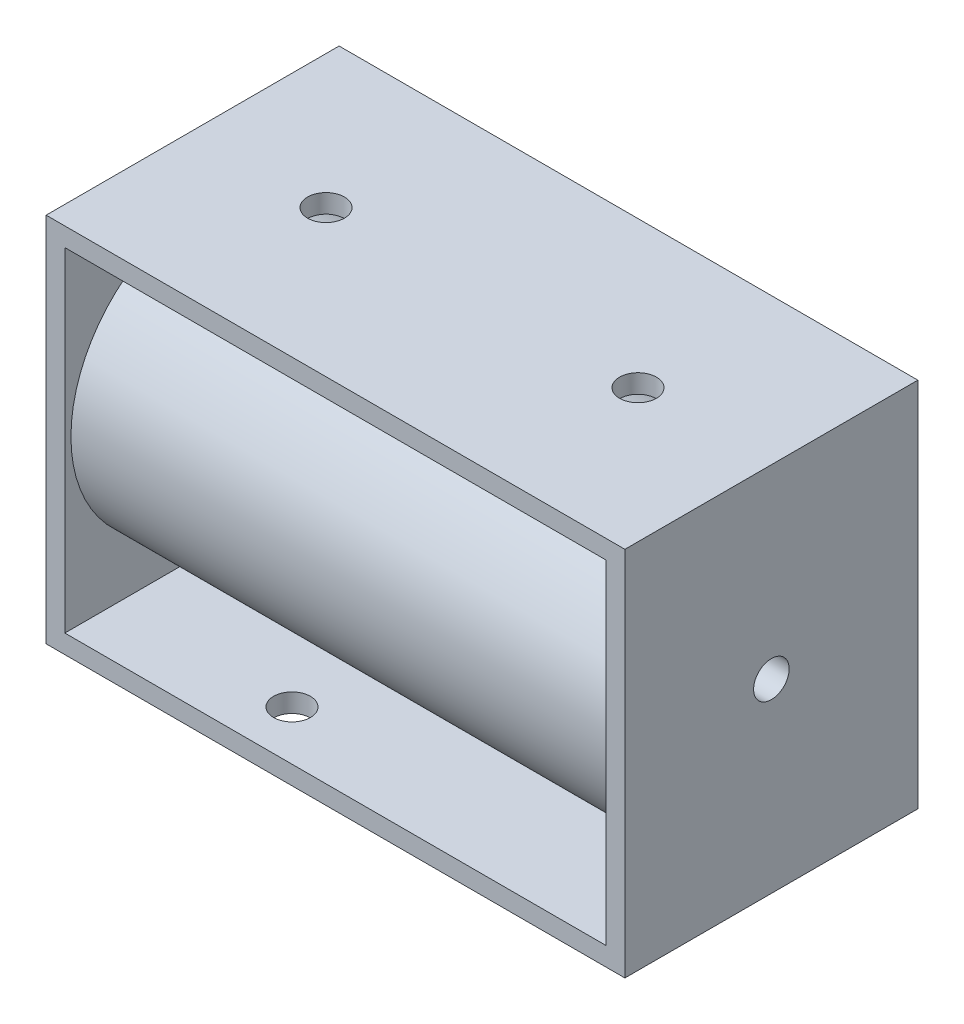
from build123d import *

# Parameters (mm, degrees)
SKETCH1_W           = 47.117
SKETCH1_H           = 30.226
BOSS_EXTRUDE1_DEPTH = 23.8506
SKETCH4_W           = 44.069
SKETCH4_H           = 27.178
CUT_EXTRUDE1_DEPTH  = 61.847957117
SKETCH5_R           = 11.43
BOSS_EXTRUDE3_DEPTH = 44.069
SKETCH3_R           = 1.4986
CUT_EXTRUDE2_DEPTH  = 2.54
CUT_EXTRUDE3_START  = -2.54
SKETCH6_R           = 1.4986
CUT_EXTRUDE3_DEPTH  = 2.54
SKETCH2_R           = 1.4478
CUT_EXTRUDE4_DEPTH  = 61.847957117
SKETCH7_R           = 4.1783
CUT_EXTRUDE5_DEPTH  = 32.1564
CHAMFER1_SIZE       = 4.064
CHAMFER1_SIZE2      = 2.346351494


with BuildPart() as part:
    # Sketch1 → Boss-Extrude1 (new body)
    with BuildSketch(Plane.XY):
        with Locations((23.5585, 15.113)):
            Rectangle(SKETCH1_W, SKETCH1_H)
    extrude(amount=BOSS_EXTRUDE1_DEPTH)

    # Sketch4 → Cut-Extrude1 (cut, through all)
    with BuildSketch(Plane.XY.offset(23.8506)):
        with Locations((23.5585, 15.113)):
            Rectangle(SKETCH4_W, SKETCH4_H)
    extrude(amount=-CUT_EXTRUDE1_DEPTH, mode=Mode.SUBTRACT)

    # Sketch5 → Boss-Extrude3 (add)
    with BuildSketch(Plane(origin=(1.524, 0, 0), x_dir=(0, 0, -1), z_dir=(1, 0, 0))):
        with Locations(Location((-11.9253, 15.113, 0), (0, 0, 180))):
            Circle(SKETCH5_R)
    extrude(amount=BOSS_EXTRUDE3_DEPTH)

    # Sketch3 → Cut-Extrude2 (cut)
    with BuildSketch(Plane(origin=(0, 30.226, 0), x_dir=(1, 0, 0), z_dir=(0, 1, 0))):
        with Locations(Location((10.8585, -11.9253, 0), (0, 0, 270))):
            Circle(SKETCH3_R)
        with Locations(Location((36.2585, -11.9253, 0), (0, 0, 270))):
            Circle(SKETCH3_R)
    extrude(amount=-CUT_EXTRUDE2_DEPTH, mode=Mode.SUBTRACT)

    # Sketch6 → Cut-Extrude3 (cut)
    with BuildSketch(Plane.XZ.offset(CUT_EXTRUDE3_START)):
        with Locations(Location((15.9766, 19.812, 0), (0, 0, 270))):
            Circle(SKETCH6_R)
        with Locations(Location((10.8585, 11.9253, 0), (0, 0, 90))):
            Circle(SKETCH6_R)
        with Locations(Location((36.5506, 4.0386, 0), (0, 0, 270))):
            Circle(SKETCH6_R)
    extrude(amount=CUT_EXTRUDE3_DEPTH, mode=Mode.SUBTRACT)

    # Sketch2 → Cut-Extrude4 (cut, through all)
    with BuildSketch(Plane(origin=(47.117, 0, 0), x_dir=(0, 0, -1), z_dir=(1, 0, 0))):
        with Locations((-11.9253, 15.113)):
            Circle(SKETCH2_R)
    extrude(amount=-CUT_EXTRUDE4_DEPTH, mode=Mode.SUBTRACT)

    # Sketch7 → Cut-Extrude5 (cut)
    with BuildSketch(Plane.ZY):
        with Locations((11.9253, 15.113)):
            Circle(SKETCH7_R)
    extrude(amount=-CUT_EXTRUDE5_DEPTH, mode=Mode.SUBTRACT)

    # Chamfer1
    chamfer1_edges = [part.edges().sort_by_distance(p)[0] for p in [
        (32.1564, 15.113, 7.747),
    ]]
    chamfer1_side = [part.faces().sort_by_distance(p)[0] for p in [
        (16.0782, 15.113, 7.747),
    ]]
    chamfer(chamfer1_edges, length=CHAMFER1_SIZE, length2=CHAMFER1_SIZE2, reference=chamfer1_side[0])


solid = part.part
